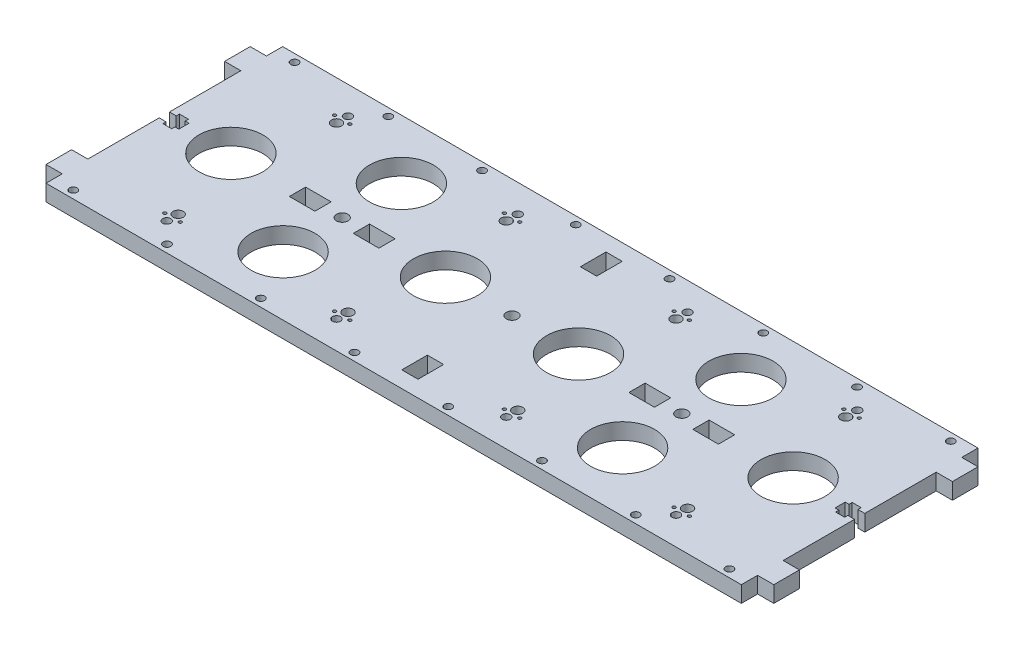
from build123d import *

# Parameters (mm, degrees)
MAIN_5_W                = 20
MAIN_5_H                = 12.7
BOSS_EXTRUDE2_DEPTH     = 6.35
CUT_EXTRUDE1_DEPTH      = 300.179502974
CUT_EXTRUDE1_DEPTH_BACK = 300.179502974
SKETCH1_W               = 12.7
SKETCH1_H               = 20
M8_CLEARANCE_HOLE2_D    = 9
CUT_EXTRUDE2_DEPTH      = 300.179502974
CUT_EXTRUDE2_DEPTH_BACK = 300.179502974
SKETCH6_R               = 4
SKETCH6_R_2             = 3.175
SKETCH6_R_3             = 1.25
CUT_EXTRUDE3_DEPTH      = 300.179502974
CUT_EXTRUDE3_DEPTH_BACK = 300.179502974
SKETCH7_R               = 25
F_6_0MM_DOWEL_HOLE2_D   = 6


with BuildPart() as part:
    # MAIN<5> → Boss-Extrude2 (new, symmetric)
    with BuildSketch(Plane(origin=(0, 0, 0), x_dir=(1, 0, 0), z_dir=(0, 1, 0))):
        Polygon((-271.75, 92.5), (-271.75, 79.8), (-284.45, 79.8), (-284.45, 59.8), (-271.75, 59.8), (-271.75, 4), (-266.45, 4), (-266.45, 6.5), (-259.45, 6.5), (-259.45, 4), (-256.45, 4), (-256.45, -4), (-259.45, -4), (-259.45, -6.5), (-266.45, -6.5), (-266.45, -4), (-271.75, -4), (-271.75, -59.8), (-284.45, -59.8), (-284.45, -79.8), (-271.75, -79.8), (-271.75, -92.5), (271.75, -92.5), (271.75, -79.8), (284.45, -79.8), (284.45, -59.8), (271.75, -59.8), (271.75, -4), (266.45, -4), (266.45, -6.5), (259.45, -6.5), (259.45, -4), (256.45, -4), (256.45, 4), (259.45, 4), (259.45, 6.5), (266.45, 6.5), (266.45, 4), (271.75, 4), (271.75, 59.8), (284.45, 59.8), (284.45, 79.8), (271.75, 79.8), (271.75, 92.5), align=None)
        with Locations((-157.7, 0)):
            Rectangle(MAIN_5_W, MAIN_5_H, mode=Mode.SUBTRACT)
        with Locations((-107.7, 0)):
            Rectangle(MAIN_5_W, MAIN_5_H, mode=Mode.SUBTRACT)
        with Locations((107.7, 0)):
            Rectangle(MAIN_5_W, MAIN_5_H, mode=Mode.SUBTRACT)
        with Locations((157.7, 0)):
            Rectangle(MAIN_5_W, MAIN_5_H, mode=Mode.SUBTRACT)
    extrude(amount=BOSS_EXTRUDE2_DEPTH, both=True)

    # Sketch1 → Cut-Extrude1 (cut, two sides: drawn at the far end of the back side and taken through both)
    with BuildSketch(Plane(origin=(0, 0, 0), x_dir=(1, 0, 0), z_dir=(0, 1, 0)).offset(-CUT_EXTRUDE1_DEPTH_BACK)):
        with Locations((0, 69.8)):
            Rectangle(SKETCH1_W, SKETCH1_H)
        with Locations((0, -69.8)):
            Rectangle(SKETCH1_W, SKETCH1_H)
    extrude(amount=CUT_EXTRUDE1_DEPTH + CUT_EXTRUDE1_DEPTH_BACK, mode=Mode.SUBTRACT)

    # M8 Clearance Hole2 (through all)
    with Locations(Plane(origin=(0, 6.35, 0), x_dir=(1, 0, 0), z_dir=(0, 1, 0))):
        with Locations((-132.7, 0), (132.7, 0), (0, 0)):
            Hole(M8_CLEARANCE_HOLE2_D / 2)

    # Sketch6 → Cut-Extrude2 (cut, two sides: drawn at the far end of the back side and taken through both)
    with BuildSketch(Plane(origin=(0, 0, 0), x_dir=(1, 0, 0), z_dir=(0, 1, 0)).offset(-CUT_EXTRUDE2_DEPTH_BACK)):
        with Locations(Location((-199.05, -61.85, 0), (0, 0, 270))):
            Circle(SKETCH6_R)
        with Locations(Location((-199.05, -70.85, 0), (0, 0, 270))):
            Circle(SKETCH6_R_2)
        with Locations(Location((-205.05, -66.35, 0), (0, 0, 270))):
            Circle(SKETCH6_R_3)
        with Locations(Location((-193.05, -66.35, 0), (0, 0, 270))):
            Circle(SKETCH6_R_3)
        with Locations(Location((-66.35, -70.85, 0), (0, 0, 270))):
            Circle(SKETCH6_R_2)
        with Locations(Location((-66.35, -61.85, 0), (0, 0, 270))):
            Circle(SKETCH6_R)
        with Locations(Location((-72.35, -66.35, 0), (0, 0, 270))):
            Circle(SKETCH6_R_3)
        with Locations(Location((-60.35, -66.35, 0), (0, 0, 270))):
            Circle(SKETCH6_R_3)
        with Locations(Location((66.35, -70.85, 0), (0, 0, 270))):
            Circle(SKETCH6_R_2)
        with Locations(Location((66.35, -61.85, 0), (0, 0, 270))):
            Circle(SKETCH6_R)
        with Locations(Location((60.35, -66.35, 0), (0, 0, 270))):
            Circle(SKETCH6_R_3)
        with Locations(Location((72.35, -66.35, 0), (0, 0, 270))):
            Circle(SKETCH6_R_3)
        with Locations(Location((199.05, -70.85, 0), (0, 0, 270))):
            Circle(SKETCH6_R_2)
        with Locations(Location((199.05, -61.85, 0), (0, 0, 270))):
            Circle(SKETCH6_R)
        with Locations(Location((193.05, -66.35, 0), (0, 0, 270))):
            Circle(SKETCH6_R_3)
        with Locations(Location((205.05, -66.35, 0), (0, 0, 270))):
            Circle(SKETCH6_R_3)
        with Locations(Location((205.05, 66.35, 0), (0, 0, 90))):
            Circle(SKETCH6_R_3)
        with Locations(Location((193.05, 66.35, 0), (0, 0, 90))):
            Circle(SKETCH6_R_3)
        with Locations(Location((199.05, 61.85, 0), (0, 0, 90))):
            Circle(SKETCH6_R)
        with Locations(Location((199.05, 70.85, 0), (0, 0, 90))):
            Circle(SKETCH6_R_2)
        with Locations(Location((72.35, 66.35, 0), (0, 0, 90))):
            Circle(SKETCH6_R_3)
        with Locations(Location((60.35, 66.35, 0), (0, 0, 90))):
            Circle(SKETCH6_R_3)
        with Locations(Location((66.35, 61.85, 0), (0, 0, 90))):
            Circle(SKETCH6_R)
        with Locations(Location((66.35, 70.85, 0), (0, 0, 90))):
            Circle(SKETCH6_R_2)
        with Locations(Location((-60.35, 66.35, 0), (0, 0, 90))):
            Circle(SKETCH6_R_3)
        with Locations(Location((-72.35, 66.35, 0), (0, 0, 90))):
            Circle(SKETCH6_R_3)
        with Locations(Location((-66.35, 61.85, 0), (0, 0, 90))):
            Circle(SKETCH6_R)
        with Locations(Location((-66.35, 70.85, 0), (0, 0, 90))):
            Circle(SKETCH6_R_2)
        with Locations(Location((-193.05, 66.35, 0), (0, 0, 90))):
            Circle(SKETCH6_R_3)
        with Locations(Location((-205.05, 66.35, 0), (0, 0, 90))):
            Circle(SKETCH6_R_3)
        with Locations(Location((-199.05, 70.85, 0), (0, 0, 90))):
            Circle(SKETCH6_R_2)
        with Locations(Location((-199.05, 61.85, 0), (0, 0, 90))):
            Circle(SKETCH6_R)
    extrude(amount=CUT_EXTRUDE2_DEPTH + CUT_EXTRUDE2_DEPTH_BACK, mode=Mode.SUBTRACT)

    # Sketch7 → Cut-Extrude3 (cut, two sides: drawn at the far end of the back side and taken through both)
    with BuildSketch(Plane(origin=(0, 0, 0), x_dir=(1, 0, 0), z_dir=(0, 1, 0)).offset(-CUT_EXTRUDE3_DEPTH_BACK)):
        with Locations(Location((-132.7, -46.25, 0), (0, 0, 270))):
            Circle(SKETCH7_R)
        with Locations(Location((132.7, -46.25, 0), (0, 0, 270))):
            Circle(SKETCH7_R)
        with Locations(Location((132.7, 46.25, 0), (0, 0, 90))):
            Circle(SKETCH7_R)
        with Locations(Location((-132.7, 46.25, 0), (0, 0, 90))):
            Circle(SKETCH7_R)
        with Locations(Location((-219.725, 0, 0), (0, 0, 270))):
            Circle(SKETCH7_R)
        with Locations(Location((-52.025, 0, 0), (0, 0, 270))):
            Circle(SKETCH7_R)
        with Locations(Location((52.025, 0, 0), (0, 0, 90))):
            Circle(SKETCH7_R)
        with Locations(Location((219.725, 0, 0), (0, 0, 90))):
            Circle(SKETCH7_R)
    extrude(amount=CUT_EXTRUDE3_DEPTH + CUT_EXTRUDE3_DEPTH_BACK, mode=Mode.SUBTRACT)

    # Ø6.0mm Dowel Hole2 (through all)
    with Locations(Plane(origin=(0, 6.35, 0), x_dir=(1, 0, 0), z_dir=(0, 1, 0))):
        with Locations((-256.45, -86.5), (-183.178571429, -86.5), (-109.907142857, -86.5), (-36.635714286, -86.5), (36.635714286, -86.5), (109.907142857, -86.5), (183.178571429, -86.5), (256.45, -86.5), (256.45, 86.5), (183.178571429, 86.5), (109.907142857, 86.5), (36.635714286, 86.5), (-36.635714286, 86.5), (-109.907142857, 86.5), (-183.178571429, 86.5), (-256.45, 86.5)):
            Hole(F_6_0MM_DOWEL_HOLE2_D / 2)


solid = part.part
